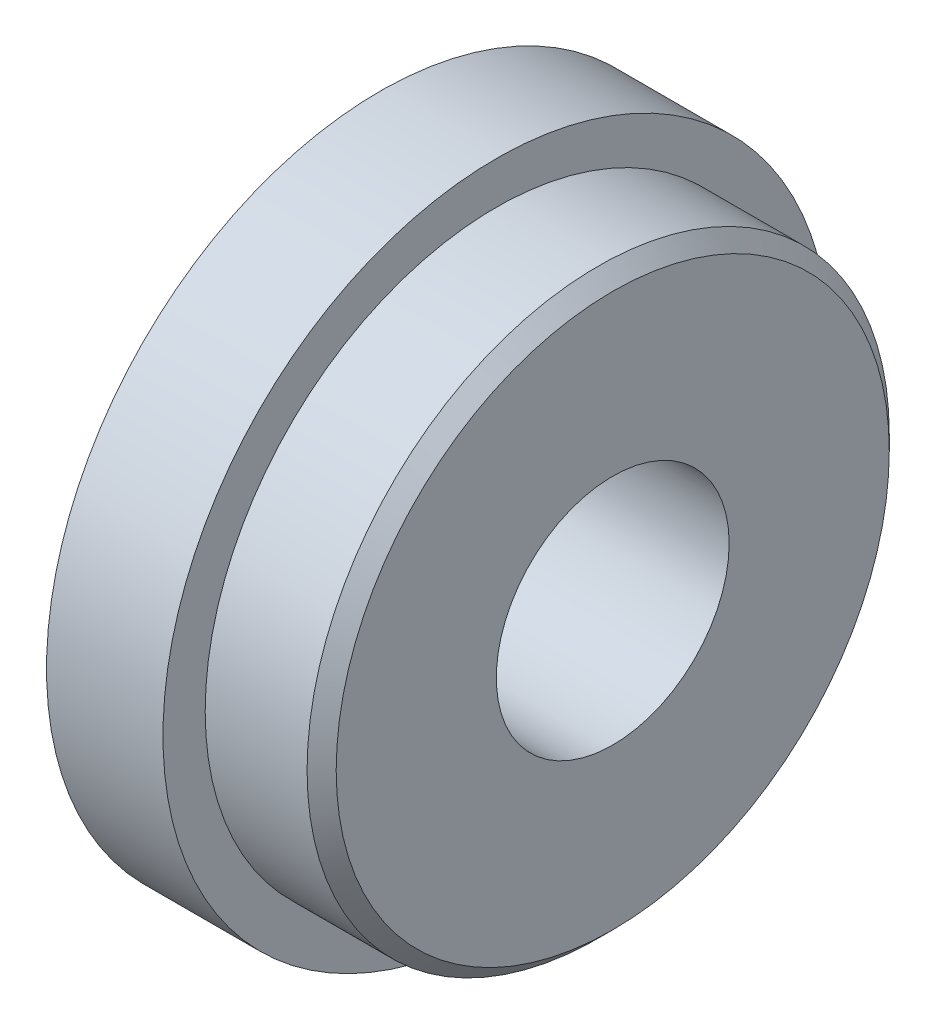
from build123d import *

# Parameters (mm, degrees)
SKETCH1_R           = 11.45
BOSS_EXTRUDE1_DEPTH = 4
SKETCH2_R           = 10
BOSS_EXTRUDE2_DEPTH = 4
SKETCH3_R           = 4
CUT_EXTRUDE1_DEPTH  = 8
CHAMFER1_SIZE       = 0.5


with BuildPart() as part:
    # Sketch1 → Boss-Extrude1 (new body)
    with BuildSketch(Plane(origin=(0, 0, 0), x_dir=(0, 0, -1), z_dir=(1, 0, 0))):
        Circle(SKETCH1_R)
    extrude(amount=BOSS_EXTRUDE1_DEPTH)

    # Sketch2 → Boss-Extrude2 (add)
    with BuildSketch(Plane(origin=(4, 0, 0), x_dir=(0, 0, -1), z_dir=(1, 0, 0))):
        Circle(SKETCH2_R)
    extrude(amount=BOSS_EXTRUDE2_DEPTH)

    # Sketch3 → Cut-Extrude1 (cut)
    with BuildSketch(Plane(origin=(8, 0, 0), x_dir=(0, 0, -1), z_dir=(1, 0, 0))):
        Circle(SKETCH3_R)
    extrude(amount=-CUT_EXTRUDE1_DEPTH, mode=Mode.SUBTRACT)

    # Chamfer1
    chamfer1_edges = [part.edges().sort_by_distance(p)[0] for p in [
        (0, 0, 4),
        (8, 0, 10),
    ]]
    chamfer(chamfer1_edges, length=CHAMFER1_SIZE)


solid = part.part
